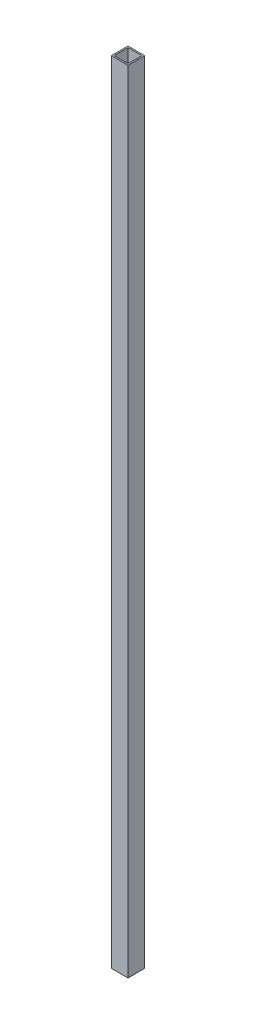
from build123d import *

# Parameters (mm, degrees)
SKETCH1_W           = 19.05
SKETCH1_H           = 19.05
SKETCH1_W_2         = 15.875
SKETCH1_H_2         = 15.875
BOSS_EXTRUDE1_DEPTH = 901.7


with BuildPart() as part:
    # Sketch1 → Boss-Extrude1 (new body)
    with BuildSketch(Plane(origin=(0, 0, 0), x_dir=(1, 0, 0), z_dir=(0, 1, 0))):
        with Locations((9.525, 9.525)):
            Rectangle(SKETCH1_W, SKETCH1_H)
        with Locations((9.525, 9.525)):
            Rectangle(SKETCH1_W_2, SKETCH1_H_2, mode=Mode.SUBTRACT)
    extrude(amount=BOSS_EXTRUDE1_DEPTH)


solid = part.part
